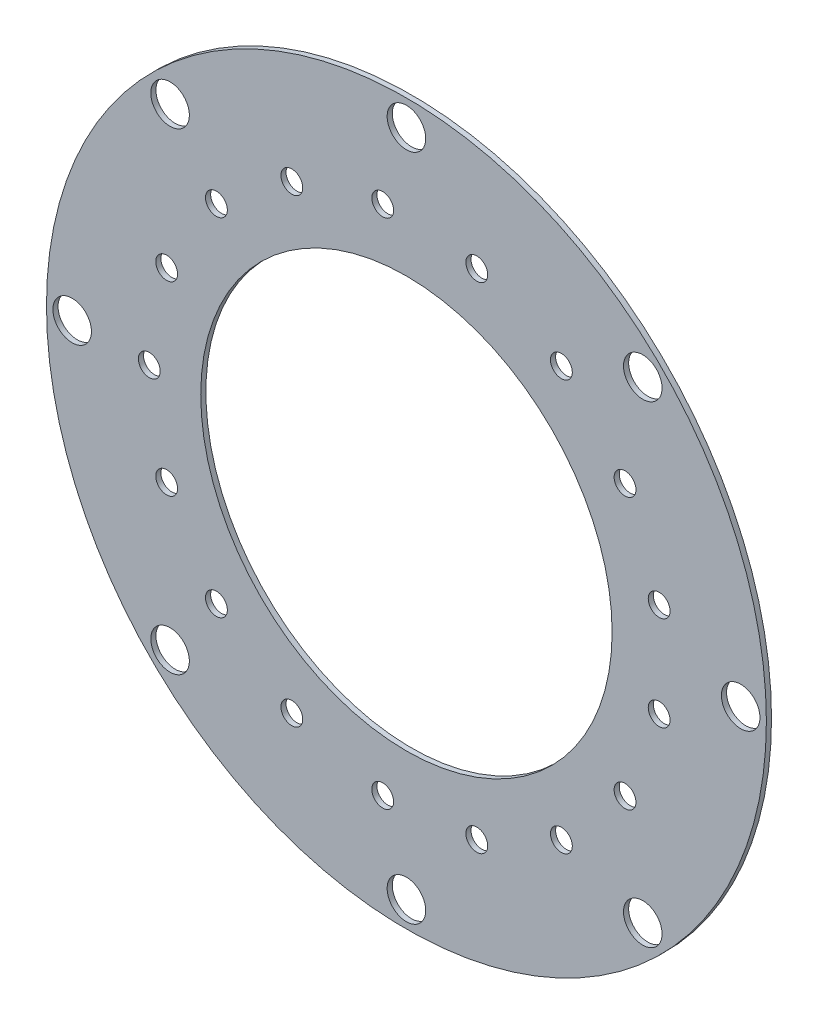
from build123d import *

# Parameters (mm, degrees)
SKETCH1_R                                        = 70
CAP_DEPTH                                        = 9.5
SKETCH2_R                                        = 2.125
DOWEL_HOLES_DEPTH                                = 101.801785698
CIRPATTERN1_COUNT                                = 17
SKETCH3_R                                        = 31.05
CENTER_HOLE_DEPTH                                = 15
SKETCH7_R                                        = 40
OUTPUTSHAFT_HOLE_DEPTH                           = 101.124921973
CBORE_FOR_M4_HEX_HEAD_MACHINE_SCREW3_D           = 3.9
CBORE_FOR_M4_HEX_HEAD_MACHINE_SCREW3_DEPTH       = 65
CBORE_FOR_M4_HEX_HEAD_MACHINE_SCREW3_CBORE_D     = 7.5
CBORE_FOR_M4_HEX_HEAD_MACHINE_SCREW3_CBORE_DEPTH = 2.63
CIRPATTERN2_COUNT                                = 8
SKETCH8_R                                        = 37.75
CUT_EXTRUDE4_DEPTH                               = 2
ALLIGNMENT_DEPTH                                 = 100.449736048
ALLIGNMENT_DEPTH_BACK                            = 100.449736048
SKETCH9_W                                        = 157.649556899
SKETCH9_H                                        = 18.162657132


with BuildPart() as part:
    # Sketch1 → Cap (new, symmetric)
    with BuildSketch(Plane.XY):
        Circle(SKETCH1_R)
    extrude(amount=CAP_DEPTH, both=True)

    # Sketch2 → Dowel Holes (cut, through all)
    with BuildSketch(Plane.XY.offset(9.5)):
        with Locations((-50, 0)):
            Circle(SKETCH2_R)
    dowel_holes = extrude(amount=-DOWEL_HOLES_DEPTH, mode=Mode.SUBTRACT)

    # CirPattern1: Dowel Holes ×17 about axis
    cirpattern1_axis = Axis((0, 0, 0), (0, 0, 1))
    for i in range(1, CIRPATTERN1_COUNT):
        add(dowel_holes.rotate(cirpattern1_axis, i * 360 / CIRPATTERN1_COUNT), mode=Mode.SUBTRACT)

    # Sketch3 → Center Hole (cut)
    with BuildSketch(Plane.XY.offset(9.5)):
        Circle(SKETCH3_R)
    extrude(amount=-CENTER_HOLE_DEPTH, mode=Mode.SUBTRACT)

    # Sketch7 → OutputShaft Hole (cut, through all)
    with BuildSketch(Plane.XY.offset(-5.5)):
        Circle(SKETCH7_R)
    extrude(amount=-OUTPUTSHAFT_HOLE_DEPTH, mode=Mode.SUBTRACT)

    # CBORE for M4 Hex Head Machine Screw3
    with Locations(Plane(origin=(0, 0, -9.5), x_dir=(-1, 0, 0), z_dir=(0, 0, -1))):
        with Locations((-65, 0)):
            cbore_for_m4_hex_head_machine_screw3 = CounterBoreHole(CBORE_FOR_M4_HEX_HEAD_MACHINE_SCREW3_D / 2, CBORE_FOR_M4_HEX_HEAD_MACHINE_SCREW3_CBORE_D / 2, CBORE_FOR_M4_HEX_HEAD_MACHINE_SCREW3_CBORE_DEPTH, depth=CBORE_FOR_M4_HEX_HEAD_MACHINE_SCREW3_DEPTH)

    # CirPattern2: CBORE for M4 Hex Head Machine Screw3 ×8 about axis
    cirpattern2_axis = Axis((0, 0, 0), (0, 0, 1))
    for i in range(1, CIRPATTERN2_COUNT):
        add(cbore_for_m4_hex_head_machine_screw3.rotate(cirpattern2_axis, i * 360 / CIRPATTERN2_COUNT), mode=Mode.SUBTRACT)

    # Sketch8 → Cut-Extrude4 (cut)
    with BuildSketch(Plane.XY.offset(9.5)):
        Circle(SKETCH8_R)
    extrude(amount=-CUT_EXTRUDE4_DEPTH, mode=Mode.SUBTRACT)

    # Sketch9 → Allignment (cut, two sides: drawn at the far end of the back side and taken through both)
    with BuildSketch(Plane(origin=(0, 0, 0), x_dir=(1, 0, 0), z_dir=(0, 1, 0)).offset(-ALLIGNMENT_DEPTH_BACK)):
        with Locations((0.351084988, -0.581328566)):
            Rectangle(SKETCH9_W, SKETCH9_H)
    extrude(amount=ALLIGNMENT_DEPTH + ALLIGNMENT_DEPTH_BACK, mode=Mode.SUBTRACT)


solid = part.part
